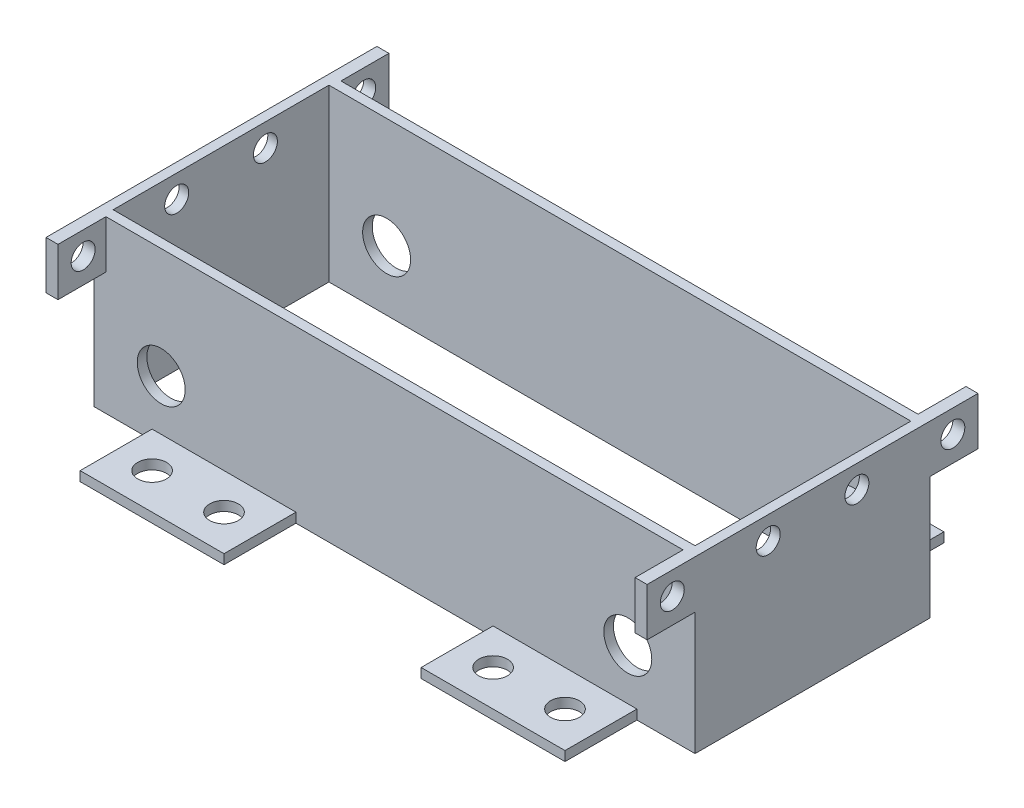
from build123d import *

# Parameters (mm, degrees)
SKETCH1_W           = 125.34
SKETCH1_H           = 35.55
SKETCH1_R           = 5
BOSS_EXTRUDE1_DEPTH = 2
SKETCH2_W           = 2
SKETCH2_H           = 35.55
BOSS_EXTRUDE2_DEPTH = 45
SKETCH4_W           = 30
SKETCH4_H           = 2
BOSS_EXTRUDE3_DEPTH = 15
SKETCH5_W           = 2.5
SKETCH5_H           = 10
BOSS_EXTRUDE4_DEPTH = 10
SKETCH3_R           = 2.5
CUT_EXTRUDE1_DEPTH  = 136.149051883
SKETCH6_R           = 3
CUT_EXTRUDE2_DEPTH  = 125.666080892


with BuildPart() as part:
    # Sketch1 → Boss-Extrude1 (new body)
    with BuildSketch(Plane.XY):
        with Locations((48.645, 5.25)):
            Rectangle(SKETCH1_W, SKETCH1_H)
        Circle(SKETCH1_R, mode=Mode.SUBTRACT)
        with Locations((97.29, 0)):
            Circle(SKETCH1_R, mode=Mode.SUBTRACT)
    boss_extrude1 = extrude(amount=BOSS_EXTRUDE1_DEPTH)

    # Sketch2 → Boss-Extrude2 (add)
    with BuildSketch(Plane(origin=(0, 0, 0), x_dir=(-1, 0, 0), z_dir=(0, 0, -1))):
        with Locations((-110.315, 5.25)):
            Rectangle(SKETCH2_W, SKETCH2_H)
    boss_extrude2 = extrude(amount=BOSS_EXTRUDE2_DEPTH)

    # Mirror1: Boss-Extrude2 across plane
    add(boss_extrude2.mirror(Plane(origin=(48.645, 0, 0), x_dir=(0, 0, 1), z_dir=(1, 0, 0))))

    # Sketch4 → Boss-Extrude3 (add)
    with BuildSketch(Plane.XY.offset(2)):
        with Locations((13.095, -11.525)):
            Rectangle(SKETCH4_W, SKETCH4_H)
        with Locations((84.195, -11.525)):
            Rectangle(SKETCH4_W, SKETCH4_H)
    boss_extrude3 = extrude(amount=BOSS_EXTRUDE3_DEPTH)

    # Sketch5 → Boss-Extrude4 (add)
    with BuildSketch(Plane.XY.offset(2)):
        with Locations((-12.775, 18.025)):
            Rectangle(SKETCH5_W, SKETCH5_H)
        with Locations((110.065, 18.025)):
            Rectangle(SKETCH5_W, SKETCH5_H)
    boss_extrude4 = extrude(amount=BOSS_EXTRUDE4_DEPTH)

    # Sketch3 → Cut-Extrude1 (cut, through all)
    with BuildSketch(Plane(origin=(111.315, 0, 0), x_dir=(0, 0, -1), z_dir=(1, 0, 0))):
        with Locations((13.25, 18.275)):
            Circle(SKETCH3_R)
        with Locations((31.75, 18.275)):
            Circle(SKETCH3_R)
        with Locations((-6.75, 18.275)):
            Circle(SKETCH3_R)
        with Locations((51.75, 18.275)):
            Circle(SKETCH3_R)
    cut_extrude1 = extrude(amount=-CUT_EXTRUDE1_DEPTH, mode=Mode.SUBTRACT)

    # Sketch6 → Cut-Extrude2 (cut, through all)
    with BuildSketch(Plane(origin=(0, -10.525, 0), x_dir=(1, 0, 0), z_dir=(0, 1, 0))):
        with Locations(Location((5.595, -9.5, 0), (0, 0, 180))):
            Circle(SKETCH6_R)
        with Locations((20.595, -9.5)):
            Circle(SKETCH6_R)
        with Locations((91.695, -9.5)):
            Circle(SKETCH6_R)
        with Locations(Location((76.695, -9.5, 0), (0, 0, 180))):
            Circle(SKETCH6_R)
    cut_extrude2 = extrude(amount=-CUT_EXTRUDE2_DEPTH, mode=Mode.SUBTRACT)

    # Mirror2: Boss-Extrude1, Boss-Extrude3, Boss-Extrude4, Cut-Extrude1, Cut-Extrude2 across plane
    add(boss_extrude1.mirror(Plane(origin=(0, 0, -22.5), x_dir=(1, 0, 0), z_dir=(0, 0, -1))))
    add(boss_extrude3.mirror(Plane(origin=(0, 0, -22.5), x_dir=(1, 0, 0), z_dir=(0, 0, -1))))
    add(boss_extrude4.mirror(Plane(origin=(0, 0, -22.5), x_dir=(1, 0, 0), z_dir=(0, 0, -1))))
    add(cut_extrude1.mirror(Plane(origin=(0, 0, -22.5), x_dir=(1, 0, 0), z_dir=(0, 0, -1))), mode=Mode.SUBTRACT)
    add(cut_extrude2.mirror(Plane(origin=(0, 0, -22.5), x_dir=(1, 0, 0), z_dir=(0, 0, -1))), mode=Mode.SUBTRACT)


solid = part.part
